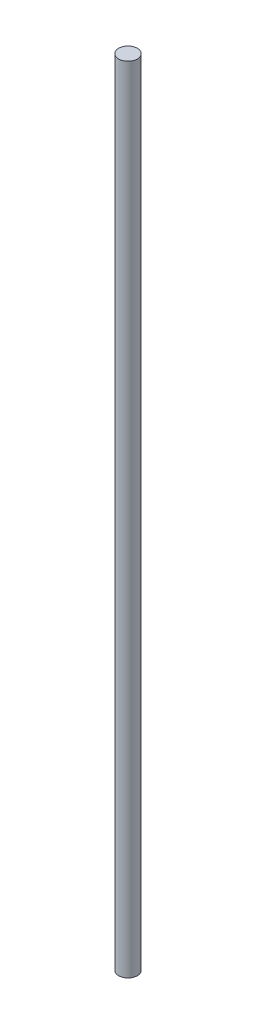
from build123d import *

# Parameters (mm, degrees)
SKETCH_1_R      = 4
EXTRUDE_1_DEPTH = 340


with BuildPart() as part:
    # 草图1 → 凸台-拉伸1 (new body)
    with BuildSketch(Plane(origin=(0, 0, 0), x_dir=(1, 0, 0), z_dir=(0, 1, 0))):
        with Locations(Location((0, 0, 0), (0, 0, 270))):
            Circle(SKETCH_1_R)
    extrude(amount=EXTRUDE_1_DEPTH)


solid = part.part
